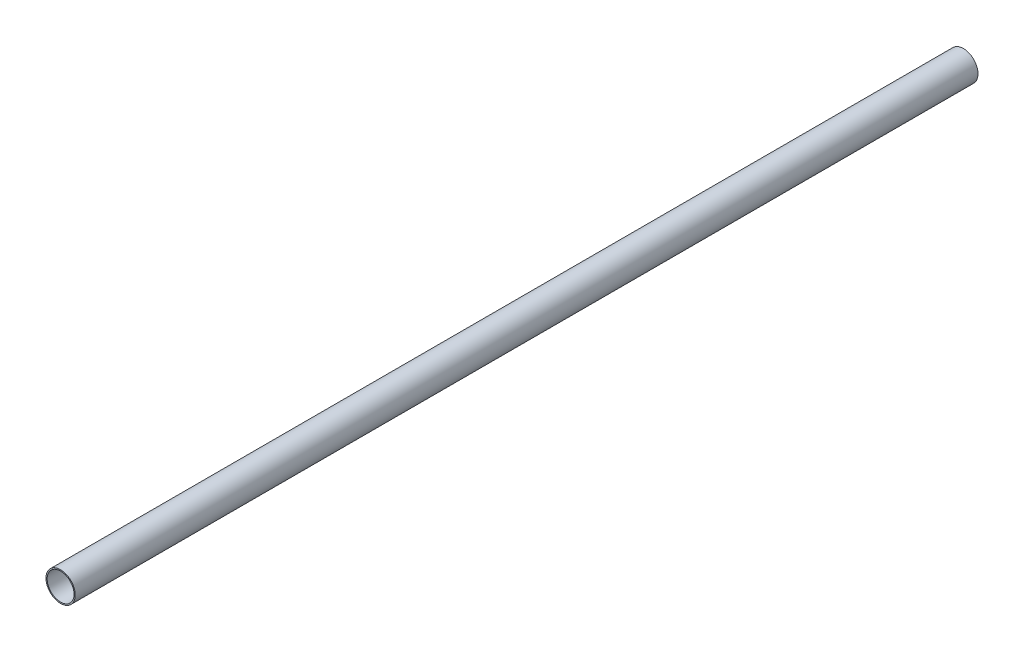
from build123d import *

# Parameters (mm, degrees)
SKETCH1_R           = 11.1125
SKETCH1_R_2         = 10.2235
BOSS_EXTRUDE1_DEPTH = 685.8


with BuildPart() as part:
    # Sketch1 → Boss-Extrude1 (new body)
    with BuildSketch(Plane.XY):
        Circle(SKETCH1_R)
        Circle(SKETCH1_R_2, mode=Mode.SUBTRACT)
    extrude(amount=BOSS_EXTRUDE1_DEPTH)


solid = part.part
